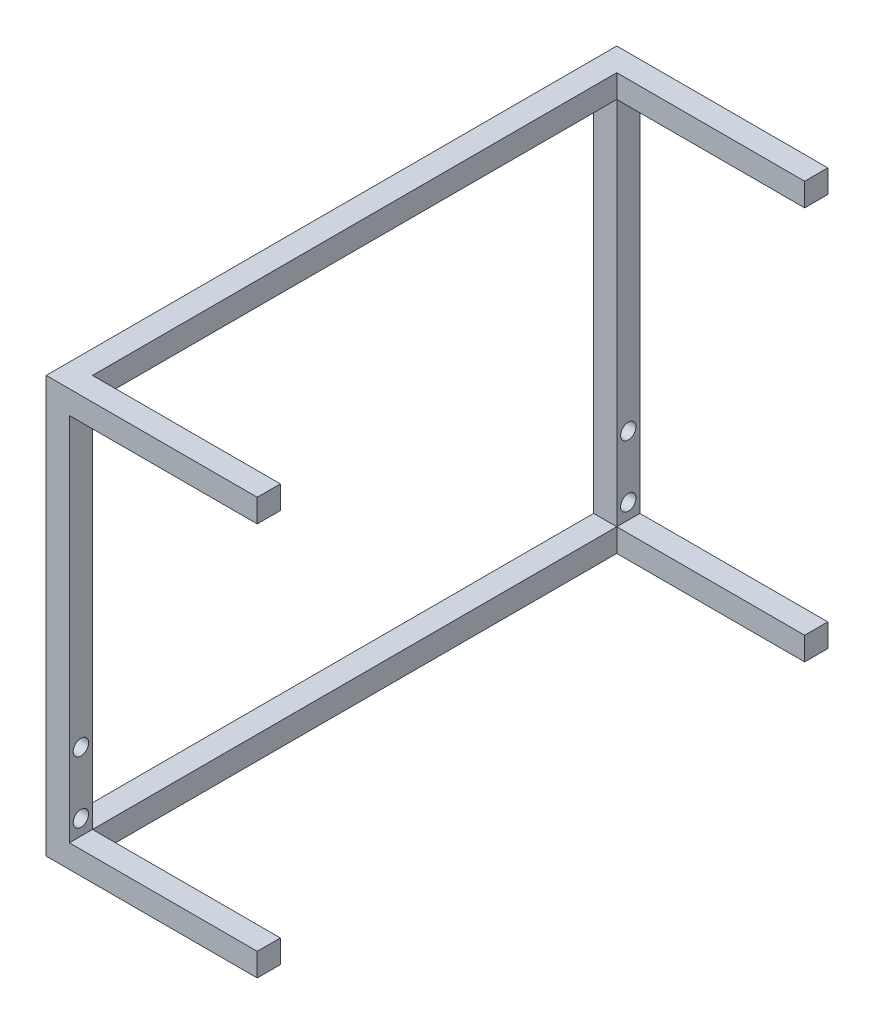
from build123d import *

# Parameters (mm, degrees)
SKETCH2_W           = 431.8
SKETCH2_H           = 19.05
SKETCH2_W_2         = 19.05
SKETCH2_H_2         = 342.9
BOSS_EXTRUDE1_DEPTH = 19.05
SKETCH3_R           = 6.35
CUT_EXTRUDE1_DEPTH  = 25.4
SKETCH4_W           = 19.05
SKETCH4_H           = 19.05
BOSS_EXTRUDE2_DEPTH = 154.7495


with BuildPart() as part:
    # Sketch2 → Boss-Extrude1 (new body)
    with BuildSketch(Plane(origin=(0, 0, 0), x_dir=(0, 0, -1), z_dir=(1, 0, 0))):
        with Locations((15.568493322, 266.398734107)):
            Rectangle(SKETCH2_W, SKETCH2_H)
        with Locations((-209.856506678, 104.473734107)):
            Rectangle(SKETCH2_W_2, SKETCH2_H_2)
        with Locations((15.568493322, -57.451265893)):
            Rectangle(SKETCH2_W, SKETCH2_H)
        Polygon((250.518493322, 275.923734107), (231.468493322, 275.923734107), (231.468493322, 256.873734107), (231.468493322, -47.926265893), (231.468493322, -66.976265893), (250.518493322, -66.976265893), align=None)
    extrude(amount=BOSS_EXTRUDE1_DEPTH)

    # Sketch3 → Cut-Extrude1 (cut)
    with BuildSketch(Plane(origin=(19.05, 0, 0), x_dir=(0, 0, -1), z_dir=(1, 0, 0))):
        with Locations((-209.856506678, 15.573734107)):
            Circle(SKETCH3_R)
        with Locations((-209.856506678, -35.226265893)):
            Circle(SKETCH3_R)
        with Locations((240.993493322, -35.226265893)):
            Circle(SKETCH3_R)
        with Locations((240.993493322, 15.573734107)):
            Circle(SKETCH3_R)
    extrude(amount=-CUT_EXTRUDE1_DEPTH, mode=Mode.SUBTRACT)

    # Sketch4 → Boss-Extrude2 (add)
    with BuildSketch(Plane(origin=(19.05, 0, 0), x_dir=(0, 0, -1), z_dir=(1, 0, 0))):
        with Locations((-209.856506678, -57.451265893)):
            Rectangle(SKETCH4_W, SKETCH4_H)
        with Locations((-209.856506678, 266.398734107)):
            Rectangle(SKETCH4_W, SKETCH4_H)
        with Locations((240.993493322, 266.398734107)):
            Rectangle(SKETCH4_W, SKETCH4_H)
        with Locations((240.993493322, -57.451265893)):
            Rectangle(SKETCH4_W, SKETCH4_H)
    extrude(amount=BOSS_EXTRUDE2_DEPTH)


solid = part.part
